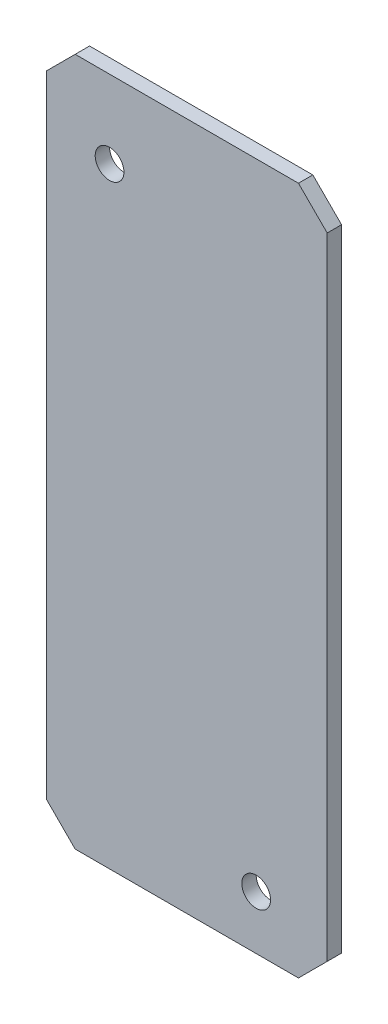
from build123d import *

# Parameters (mm, degrees)
ESQUISSE1_W      = 19.540548481
ESQUISSE1_H      = 47.905200599
ESQUISSE1_R      = 1
EXTRUSION1_DEPTH = 1
CHANFREIN1_SIZE  = 2


with BuildPart() as part:
    # Esquisse1 → Extrusion1 (new body)
    with BuildSketch(Plane.XY):
        with Locations((-42.09577401, -60.566266396)):
            Rectangle(ESQUISSE1_W, ESQUISSE1_H)
        with Locations((-37.268833007, -80.789072635)):
            Circle(ESQUISSE1_R, mode=Mode.SUBTRACT)
        with Locations((-47.471458714, -42.022391679)):
            Circle(ESQUISSE1_R, mode=Mode.SUBTRACT)
    extrude(amount=EXTRUSION1_DEPTH)

    # Chanfrein1
    chanfrein1_edges = [part.edges().sort_by_distance(p)[0] for p in [
        (-51.86604825, -36.613666097, 0.5),
        (-32.325499769, -36.613666097, 0.5),
        (-32.325499769, -84.518866696, 0.5),
        (-51.86604825, -84.518866696, 0.5),
    ]]
    chamfer(chanfrein1_edges, length=CHANFREIN1_SIZE)


solid = part.part
